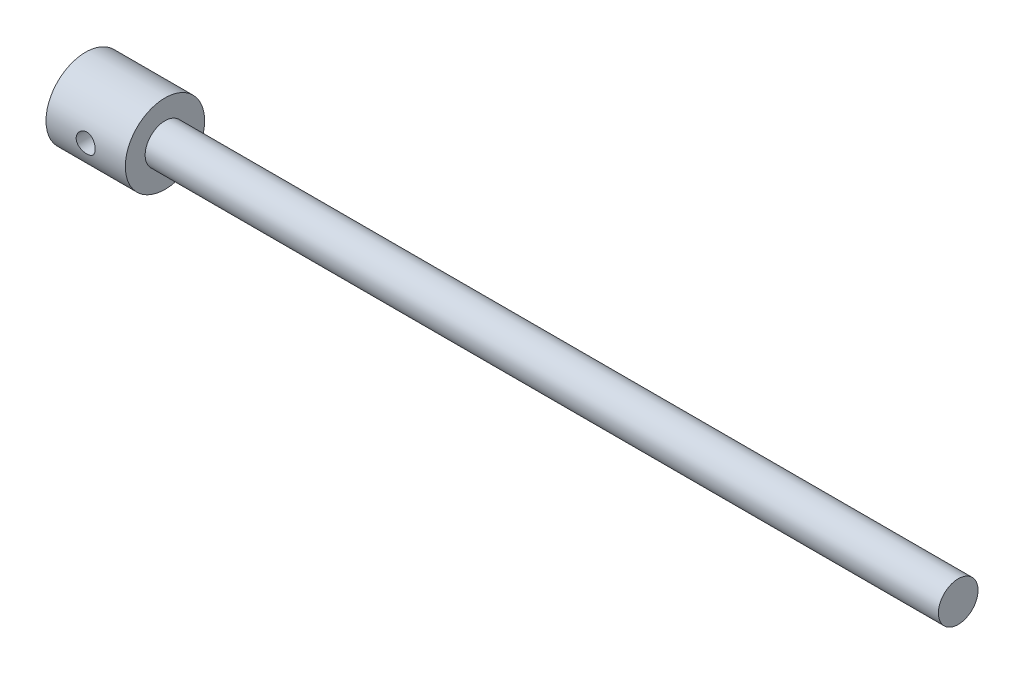
from build123d import *

# Parameters (mm, degrees)
CUT_EXTRUDE1_DEPTH      = 552.135192126
CUT_EXTRUDE1_DEPTH_BACK = 552.135192126
SKETCH2_R               = 6


with BuildPart() as part:
    # Sketch1 → Revolve1 (revolve)
    with BuildSketch(Plane.XY, mode=Mode.PRIVATE) as revolve1_sk:
        Polygon((0, 0), (550, 0), (550, 12.5), (50, 12.5), (50, 25), (0, 25), align=None)
    revolve(revolve1_sk.sketch.rotate(Axis((0, 0, 0), (1, 0, 0)), 90), axis=Axis((0, 0, 0), (1, 0, 0)))

    # Sketch2 → Cut-Extrude1 (cut, two sides: drawn at the far end of the back side and taken through both)
    with BuildSketch(Plane.XY.offset(-CUT_EXTRUDE1_DEPTH_BACK)):
        with Locations((25, 0)):
            Circle(SKETCH2_R)
    extrude(amount=CUT_EXTRUDE1_DEPTH + CUT_EXTRUDE1_DEPTH_BACK, mode=Mode.SUBTRACT)


solid = part.part
